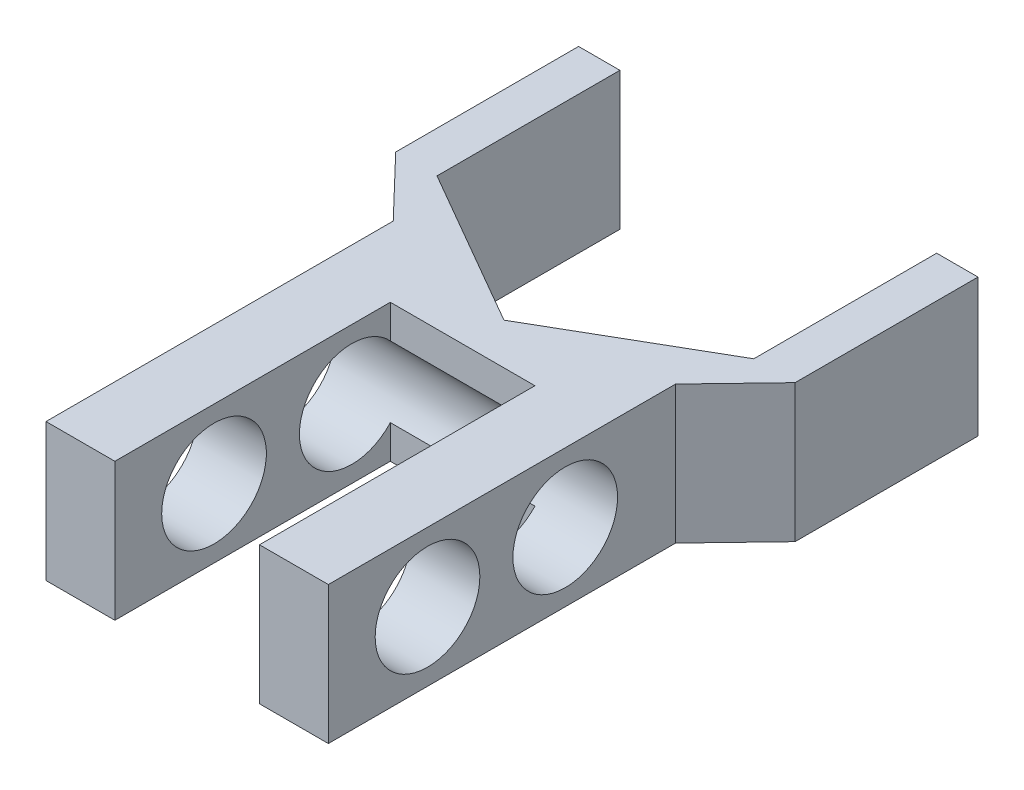
from build123d import *

# Parameters (mm, degrees)
BOSS_EXTRUDE1_DEPTH = 10
SKETCH3_R           = 3.8
CUT_EXTRUDE1_DEPTH  = 46.041452221


with BuildPart() as part:
    # Sketch1 → Boss-Extrude1 (new body)
    with BuildSketch(Plane(origin=(0, 0, 0), x_dir=(1, 0, 0), z_dir=(0, 1, 0))):
        Polygon((-11.5, -6.639528096), (-11.5, 6.639528096), (-14.5, 6.639528096), (-14.5, -6.639528096), (-10.25, -11.068500464), (-10.25, -36.279056191), (-5.25, -36.279056191), (-5.25, -16.279056191), (5.25, -16.279056191), (5.25, -36.279056191), (10.25, -36.279056191), (10.25, -11.068500464), (14.5, -6.639528096), (14.5, 6.639528096), (11.5, 6.639528096), (11.5, -6.639528096), (0, -13.279056191), align=None)
    extrude(amount=BOSS_EXTRUDE1_DEPTH)

    # Sketch3 → Cut-Extrude1 (cut, through all)
    with BuildSketch(Plane.ZY.offset(10.25)):
        with Locations((19.079056191, 5)):
            Circle(SKETCH3_R)
        with Locations((29.079056191, 5)):
            Circle(SKETCH3_R)
    extrude(amount=-CUT_EXTRUDE1_DEPTH, mode=Mode.SUBTRACT)


solid = part.part
